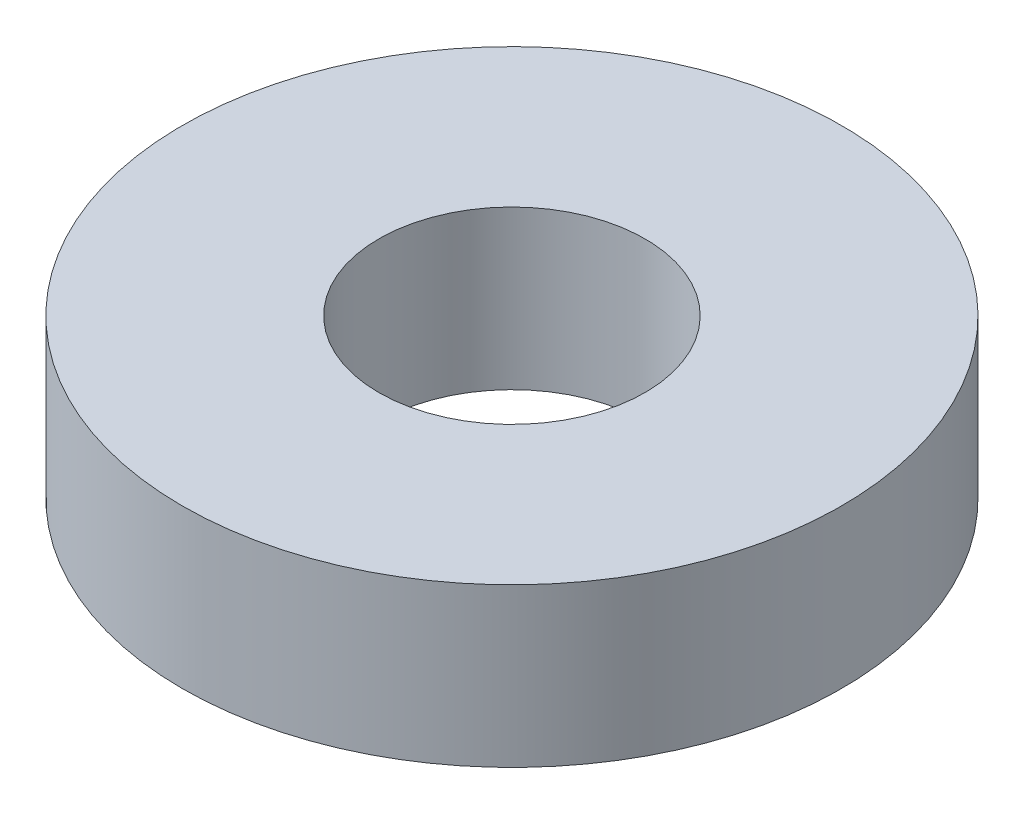
from build123d import *

# Parameters (mm, degrees)
DODANIE_WYCI_GNI_CIE1_DEPTH = 6
SZKIC3_R                    = 5.05
WYTNIJ_WYCI_GNI_CIE1_DEPTH  = 418.898779611
SZKIC4_OUTSIDE_W            = 37.616
SZKIC4_OUTSIDE_H            = 51.616
SZKIC4_OUTSIDE_R            = 12.5
WYTNIJ_WYCI_GNI_CIE2_DEPTH  = 10


with BuildPart() as part:
    # Szkic1 → Dodanie-wyciągnięcie1 (new body)
    with BuildSketch(Plane(origin=(0, -358.273993717, 0), x_dir=(1, 0, 0), z_dir=(0, 1, 0))):
        with BuildLine():
            Line((-393.068007623, -130.155243162), (-375.068007623, -130.155243162))
            ThreePointArc((-375.068007623, -130.155243162), (-372.239580498, -128.983670286), (-371.068007623, -126.155243162))
            Line((-371.068007623, -126.155243162), (-371.068007623, -94.155243162))
            ThreePointArc((-371.068007623, -94.155243162), (-372.239580498, -91.326816037), (-375.068007623, -90.155243162))
            Line((-375.068007623, -90.155243162), (-393.068007623, -90.155243162))
            ThreePointArc((-393.068007623, -90.155243162), (-395.896434748, -91.326816037), (-397.068007623, -94.155243162))
            Line((-397.068007623, -94.155243162), (-397.068007623, -126.155243162))
            ThreePointArc((-397.068007623, -126.155243162), (-395.896434748, -128.983670286), (-393.068007623, -130.155243162))
        make_face()
    extrude(amount=DODANIE_WYCI_GNI_CIE1_DEPTH)

    # Szkic3 → Wytnij-wyciągnięcie1 (cut, through all)
    with BuildSketch(Plane(origin=(0, -352.273993717, 0), x_dir=(1, 0, 0), z_dir=(0, 1, 0))):
        with Locations(Location((-384.068007623, -110.155243162, 0), (0, 0, 270))):
            Circle(SZKIC3_R)
    extrude(amount=-WYTNIJ_WYCI_GNI_CIE1_DEPTH, mode=Mode.SUBTRACT)

    # Szkic4 outside → Wytnij-wyciągnięcie2 (cut)
    with BuildSketch(Plane(origin=(0, -352.273993717, 0), x_dir=(1, 0, 0), z_dir=(0, 1, 0))):
        with Locations((-384.068, -110.155)):
            Rectangle(SZKIC4_OUTSIDE_W, SZKIC4_OUTSIDE_H)
        with Locations(Location((-384.068007623, -110.155243162, 0), (0, 0, 270))):
            Circle(SZKIC4_OUTSIDE_R, mode=Mode.SUBTRACT)
    extrude(amount=-WYTNIJ_WYCI_GNI_CIE2_DEPTH, mode=Mode.SUBTRACT)


solid = part.part
